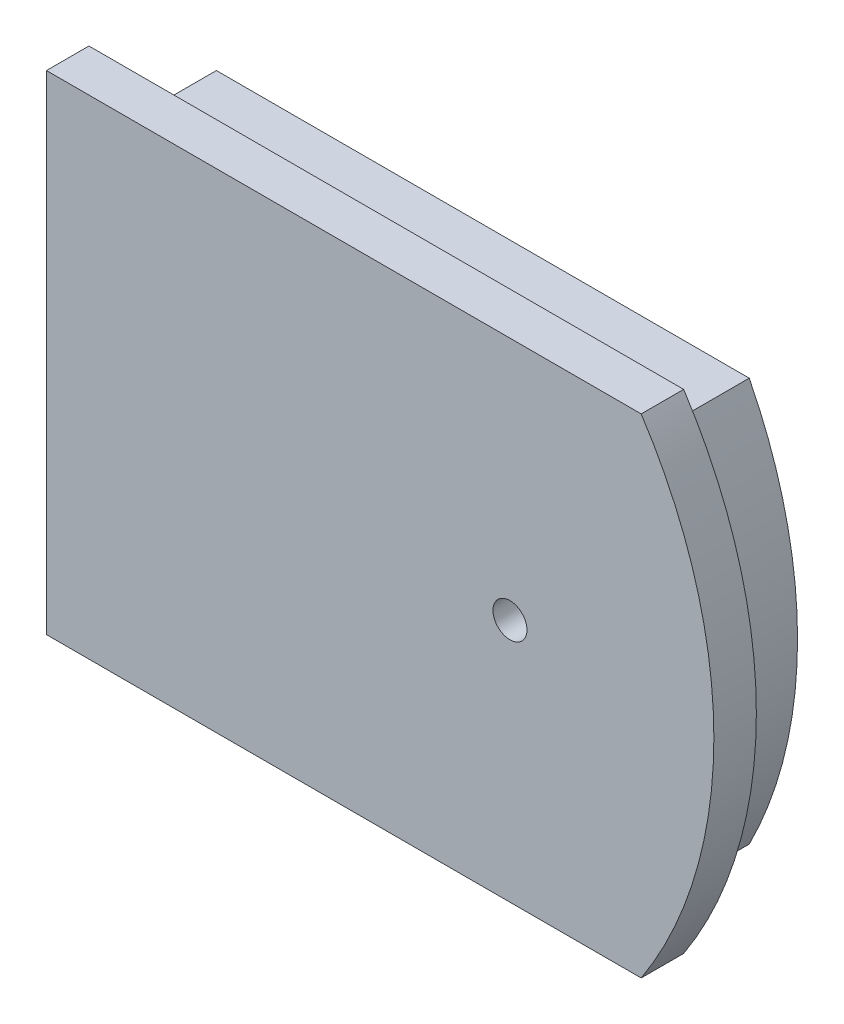
from build123d import *

# Parameters (mm, degrees)
SKETCH_1_W          = 140
SKETCH_1_H          = 115
EXTRUDE_1_DEPTH     = 10
EXTRUDE_3_DEPTH     = 10
SKETCH_3_R          = 35
CUT_EXTRUDE_2_DEPTH = 10
SKETCH_4_R          = 35
EXTRUDE_4_DEPTH     = 10
SKETCH_5_R          = 4
CUT_EXTRUDE_3_DEPTH = 105.85349984
SKETCH_6_W          = 125.431788303
SKETCH_6_H          = 95
EXTRUDE_5_DEPTH     = 20
EXTRUDE_6_DEPTH     = 20
SKETCH_8_R          = 4
CUT_EXTRUDE_5_DEPTH = 107.274439207


with BuildPart() as part:
    # 草图1 → 凸台-拉伸1 (new body)
    with BuildSketch(Plane.XY):
        Rectangle(SKETCH_1_W, SKETCH_1_H)
    extrude(amount=EXTRUDE_1_DEPTH)

    # 草图2 → 凸台-拉伸3 (add)
    with BuildSketch(Plane.XY.offset(10)):
        with BuildLine():
            ThreePointArc((87.109163862, 0), (82.741171521, 29.995722562), (70, 57.5))
            Line((70, 57.5), (70, -57.5))
            ThreePointArc((70, -57.5), (82.741171521, -29.995722562), (87.109163862, 0))
        make_face()
    extrude(amount=-EXTRUDE_3_DEPTH)

    # 草图3 → 切除-拉伸2 (cut)
    with BuildSketch(Plane.XY.offset(10)):
        with Locations((37.109163862, 0)):
            Circle(SKETCH_3_R)
    extrude(amount=-CUT_EXTRUDE_2_DEPTH, mode=Mode.SUBTRACT)

    # 草图4 → 凸台-拉伸4 (add)
    with BuildSketch(Plane.XY.offset(10)):
        with Locations((37.109163862, 0)):
            Circle(SKETCH_4_R)
    extrude(amount=-EXTRUDE_4_DEPTH)

    # 草图5 → 切除-拉伸3 (cut, through all)
    with BuildSketch(Plane.XY.offset(10)):
        with Locations((39.109163862, 0)):
            Circle(SKETCH_5_R)
    extrude(amount=-CUT_EXTRUDE_3_DEPTH, mode=Mode.SUBTRACT)

    # 草图6 → 凸台-拉伸5 (add)
    with BuildSketch(Plane(origin=(0, 0, 0), x_dir=(-1, 0, 0), z_dir=(0, 0, -1))):
        with Locations((-2.715894151, 0)):
            Rectangle(SKETCH_6_W, SKETCH_6_H)
    extrude(amount=EXTRUDE_5_DEPTH)

    # 草图7 → 凸台-拉伸6 (add)
    with BuildSketch(Plane(origin=(0, 0, -20), x_dir=(-1, 0, 0), z_dir=(0, 0, -1))):
        with BuildLine():
            Line((-65.431788303, -47.5), (-65.431788303, 47.5))
            ThreePointArc((-65.431788303, 47.5), (-76.80558662, 0), (-65.431788303, -47.5))
        make_face()
    extrude(amount=-EXTRUDE_6_DEPTH)

    # 草图8 → 切除-拉伸5 (cut, through all)
    with BuildSketch(Plane.XY):
        with Locations((39.109163862, 0)):
            Circle(SKETCH_8_R)
    extrude(amount=-CUT_EXTRUDE_5_DEPTH, mode=Mode.SUBTRACT)


solid = part.part
